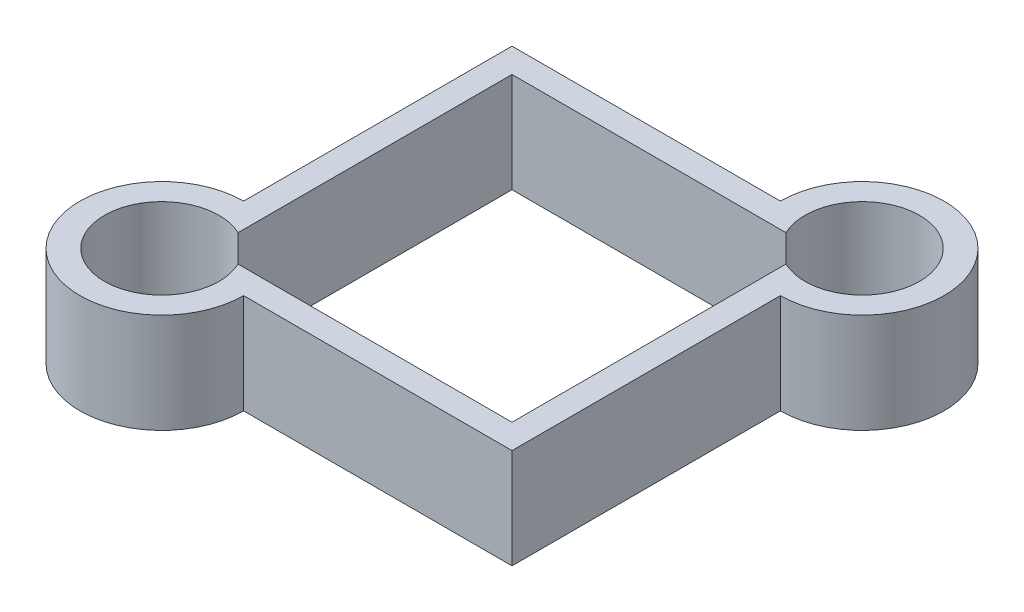
from build123d import *

# Parameters (mm, degrees)
BOSS_EXTRUDE1_DEPTH = 61


with BuildPart() as part:
    # Sketch1 → Boss-Extrude1 (new body)
    with BuildSketch(Plane(origin=(0, 0, 0), x_dir=(1, 0, 0), z_dir=(0, 1, 0))):
        with BuildLine():
            Line((-107, 107), (57, 107))
            ThreePointArc((57, 107), (142.355339059, 142.355339059), (107, 57))
            Line((107, 57), (107, -107))
            Line((107, -107), (-57, -107))
            ThreePointArc((-57, -107), (-142.355339059, -142.355339059), (-107, -57))
            Line((-107, -57), (-107, 107))
        make_face()
        with BuildLine():
            Line((-92, 92), (75.377223398, 92))
            ThreePointArc((75.377223398, 92), (131.748737342, 131.748737342), (92, 75.377223398))
            Line((92, 75.377223398), (92, -92))
            Line((92, -92), (-75.377223398, -92))
            ThreePointArc((-75.377223398, -92), (-131.748737342, -131.748737342), (-92, -75.377223398))
            Line((-92, -75.377223398), (-92, 92))
        make_face(mode=Mode.SUBTRACT)
    extrude(amount=BOSS_EXTRUDE1_DEPTH)


solid = part.part
